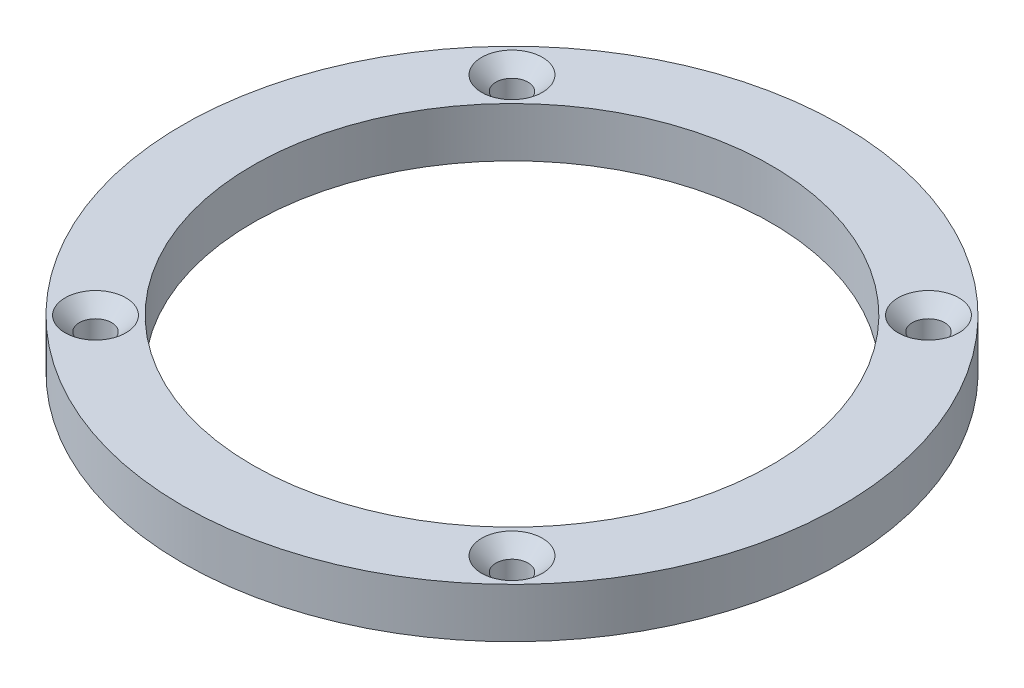
from build123d import *

# Parameters (mm, degrees)
SKETCH1_R                                       = 56.4
SKETCH1_R_2                                     = 44.4
BOSS_EXTRUDE1_DEPTH                             = 8.5
CSK_FOR_M5_FLAT_HEAD_MACHINE_SCREW1_D           = 5.5
CSK_FOR_M5_FLAT_HEAD_MACHINE_SCREW1_DEPTH       = 30
CSK_FOR_M5_FLAT_HEAD_MACHINE_SCREW1_CSINK_D     = 10.4
CSK_FOR_M5_FLAT_HEAD_MACHINE_SCREW1_CSINK_ANGLE = 90
CSK_FOR_M5_FLAT_HEAD_MACHINE_SCREW1_TIP         = 1.652366702


with BuildPart() as part:
    # Sketch1 → Boss-Extrude1 (new body)
    with BuildSketch(Plane(origin=(0, 0, 0), x_dir=(1, 0, 0), z_dir=(0, 1, 0))):
        with Locations(Location((0, 0, 0), (0, 0, 270))):
            Circle(SKETCH1_R)
        with Locations(Location((0, 0, 0), (0, 0, 270))):
            Circle(SKETCH1_R_2, mode=Mode.SUBTRACT)
    extrude(amount=BOSS_EXTRUDE1_DEPTH)

    # CSK for M5 Flat Head Machine Screw1
    with Locations(Plane(origin=(0, 8.5, 0), x_dir=(1, 0, 0), z_dir=(0, 1, 0))):
        with Locations((35.638181772, 35.638181772), (35.638181772, -35.638181772), (-35.638181772, -35.638181772), (-35.638181772, 35.638181772)):
            CounterSinkHole(CSK_FOR_M5_FLAT_HEAD_MACHINE_SCREW1_D / 2, CSK_FOR_M5_FLAT_HEAD_MACHINE_SCREW1_CSINK_D / 2, depth=CSK_FOR_M5_FLAT_HEAD_MACHINE_SCREW1_DEPTH, counter_sink_angle=CSK_FOR_M5_FLAT_HEAD_MACHINE_SCREW1_CSINK_ANGLE)
            with Locations((0, 0, -(CSK_FOR_M5_FLAT_HEAD_MACHINE_SCREW1_DEPTH + CSK_FOR_M5_FLAT_HEAD_MACHINE_SCREW1_TIP / 2))):  # 118° drill point
                Cone(0, CSK_FOR_M5_FLAT_HEAD_MACHINE_SCREW1_D / 2, CSK_FOR_M5_FLAT_HEAD_MACHINE_SCREW1_TIP, mode=Mode.SUBTRACT)


solid = part.part
